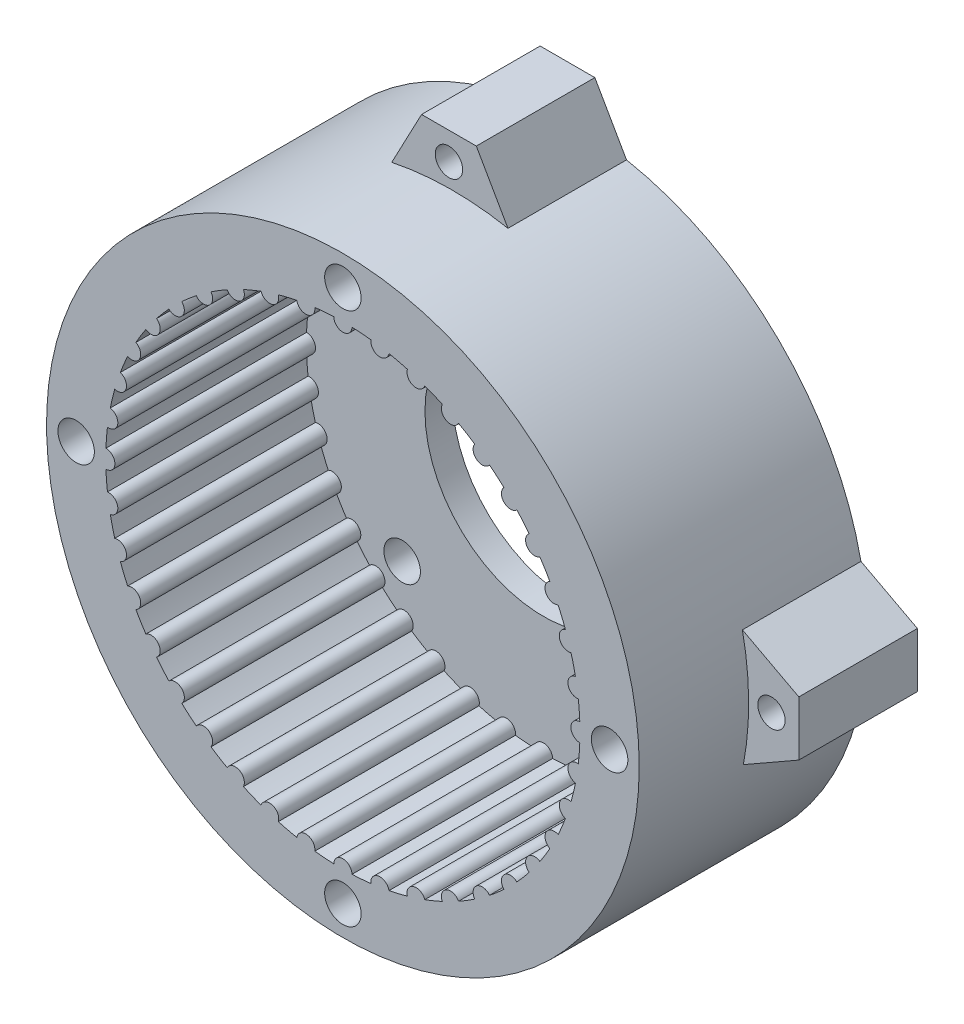
from build123d import *

# Parameters (mm, degrees)
ESQUISSE2_R                  = 32.5
BOSS_EXTRU_1_DEPTH           = 25
ESQUISSE3_R                  = 1
ENL_V_MAT_EXTRU_1_DEPTH      = 24
ESQUISSE4_R                  = 26
ENL_V_MAT_EXTRU_2_DEPTH      = 22
ESQUISSE5_R                  = 13
ENL_V_MAT_EXTRU_3_DEPTH      = 51.955863254
ESQUISSE6_R                  = 2
ENL_V_MAT_EXTRU_4_DEPTH      = 51.955863254
BOSS_EXTRU_2_START           = 24
ESQUISSE7_R                  = 1
BOSS_EXTRU_2_DEPTH           = 24
R_P_TITION_CIRCULAIRE1_COUNT = 40
ESQUISSE8_R                  = 2
ENL_V_MAT_EXTRU_5_DEPTH      = 7
R_P_TITION_CIRCULAIRE2_COUNT = 4
ESQUISSE9_R                  = 2
ENL_V_MAT_EXTRU_6_DEPTH      = 7
R_P_TITION_CIRCULAIRE3_COUNT = 4
BOSS_EXTRU_3_START           = -13
ESQUISSE11_R                 = 1.5
BOSS_EXTRU_3_DEPTH           = 13
R_P_TITION_CIRCULAIRE5_COUNT = 4


with BuildPart() as part:
    # Esquisse2 → Boss.-Extru.1 (new body)
    with BuildSketch(Plane.XY):
        Circle(ESQUISSE2_R)
    extrude(amount=BOSS_EXTRU_1_DEPTH)

    # Esquisse3 → Enlèv. mat.-Extru.1 (cut)
    with BuildSketch(Plane.XY.offset(25)):
        with Locations((0, 26)):
            Circle(ESQUISSE3_R)
        with Locations((4.067296091, 25.679896855)):
            Circle(ESQUISSE3_R)
        with Locations((8.034441854, 24.727469424)):
            Circle(ESQUISSE3_R)
        with Locations((11.803752993, 23.166169629)):
            Circle(ESQUISSE3_R)
        with Locations((15.28241656, 21.034441854)):
            Circle(ESQUISSE3_R)
        with Locations((18.384776311, 18.384776311)):
            Circle(ESQUISSE3_R)
        with Locations((21.034441854, 15.28241656)):
            Circle(ESQUISSE3_R)
        with Locations((23.166169629, 11.803752993)):
            Circle(ESQUISSE3_R)
        with Locations((24.727469424, 8.034441854)):
            Circle(ESQUISSE3_R)
        with Locations((25.679896855, 4.067296091)):
            Circle(ESQUISSE3_R)
        with Locations((26, 0)):
            Circle(ESQUISSE3_R)
        with Locations((25.679896855, -4.067296091)):
            Circle(ESQUISSE3_R)
        with Locations((24.727469424, -8.034441854)):
            Circle(ESQUISSE3_R)
        with Locations((23.166169629, -11.803752993)):
            Circle(ESQUISSE3_R)
        with Locations((21.034441854, -15.28241656)):
            Circle(ESQUISSE3_R)
        with Locations((18.384776311, -18.384776311)):
            Circle(ESQUISSE3_R)
        with Locations((15.28241656, -21.034441854)):
            Circle(ESQUISSE3_R)
        with Locations((11.803752993, -23.166169629)):
            Circle(ESQUISSE3_R)
        with Locations((8.034441854, -24.727469424)):
            Circle(ESQUISSE3_R)
        with Locations((4.067296091, -25.679896855)):
            Circle(ESQUISSE3_R)
        with Locations((0, -26)):
            Circle(ESQUISSE3_R)
        with Locations((-4.067296091, -25.679896855)):
            Circle(ESQUISSE3_R)
        with Locations((-8.034441854, -24.727469424)):
            Circle(ESQUISSE3_R)
        with Locations((-11.803752993, -23.166169629)):
            Circle(ESQUISSE3_R)
        with Locations((-15.28241656, -21.034441854)):
            Circle(ESQUISSE3_R)
        with Locations((-18.384776311, -18.384776311)):
            Circle(ESQUISSE3_R)
        with Locations((-21.034441854, -15.28241656)):
            Circle(ESQUISSE3_R)
        with Locations((-23.166169629, -11.803752993)):
            Circle(ESQUISSE3_R)
        with Locations((-24.727469424, -8.034441854)):
            Circle(ESQUISSE3_R)
        with Locations((-25.679896855, -4.067296091)):
            Circle(ESQUISSE3_R)
        with Locations((-26, 0)):
            Circle(ESQUISSE3_R)
        with Locations((-25.679896855, 4.067296091)):
            Circle(ESQUISSE3_R)
        with Locations((-24.727469424, 8.034441854)):
            Circle(ESQUISSE3_R)
        with Locations((-23.166169629, 11.803752993)):
            Circle(ESQUISSE3_R)
        with Locations((-21.034441854, 15.28241656)):
            Circle(ESQUISSE3_R)
        with Locations((-18.384776311, 18.384776311)):
            Circle(ESQUISSE3_R)
        with Locations((-15.28241656, 21.034441854)):
            Circle(ESQUISSE3_R)
        with Locations((-11.803752993, 23.166169629)):
            Circle(ESQUISSE3_R)
        with Locations((-8.034441854, 24.727469424)):
            Circle(ESQUISSE3_R)
        with Locations((-4.067296091, 25.679896855)):
            Circle(ESQUISSE3_R)
    extrude(amount=-ENL_V_MAT_EXTRU_1_DEPTH, mode=Mode.SUBTRACT)

    # Esquisse4 → Enlèv. mat.-Extru.2 (cut)
    with BuildSketch(Plane.XY.offset(25)):
        Circle(ESQUISSE4_R)
    extrude(amount=-ENL_V_MAT_EXTRU_2_DEPTH, mode=Mode.SUBTRACT)

    # Esquisse5 → Enlèv. mat.-Extru.3 (cut, through all)
    with BuildSketch(Plane.XY.offset(3)):
        Circle(ESQUISSE5_R)
    extrude(amount=-ENL_V_MAT_EXTRU_3_DEPTH, mode=Mode.SUBTRACT)

    # Esquisse6 → Enlèv. mat.-Extru.4 (cut, through all)
    with BuildSketch(Plane.XY.offset(3)):
        with Locations((-15.5, 15.5)):
            Circle(ESQUISSE6_R)
        with Locations((15.5, 15.5)):
            Circle(ESQUISSE6_R)
        with Locations((15.5, -15.5)):
            Circle(ESQUISSE6_R)
        with Locations((-15.5, -15.5)):
            Circle(ESQUISSE6_R)
    extrude(amount=-ENL_V_MAT_EXTRU_4_DEPTH, mode=Mode.SUBTRACT)

    # Esquisse7 → Boss.-Extru.2 (add)
    with BuildSketch(Plane.XY.offset(1).offset(BOSS_EXTRU_2_START)):
        with Locations((-21.034441854, 15.28241656)):
            Circle(ESQUISSE7_R)
    boss_extru_2 = extrude(amount=-BOSS_EXTRU_2_DEPTH)

    # Répétition circulaire1: Boss.-Extru.2 ×40 about axis
    r_p_tition_circulaire1_axis = Axis((0, 0, 0), (0, 0, 1))
    for i in range(1, R_P_TITION_CIRCULAIRE1_COUNT):
        add(boss_extru_2.rotate(r_p_tition_circulaire1_axis, i * 360 / R_P_TITION_CIRCULAIRE1_COUNT))

    # Esquisse8 → Enlèv. mat.-Extru.5 (cut)
    with BuildSketch(Plane.XY.offset(25)):
        with Locations((0, 29.25)):
            Circle(ESQUISSE8_R)
    enl_v_mat_extru_5 = extrude(amount=-ENL_V_MAT_EXTRU_5_DEPTH, mode=Mode.SUBTRACT)

    # Répétition circulaire2: Enlèv. mat.-Extru.5 ×4 about axis
    r_p_tition_circulaire2_axis = Axis((0, 0, 0), (0, 0, 1))
    for i in range(1, R_P_TITION_CIRCULAIRE2_COUNT):
        add(enl_v_mat_extru_5.rotate(r_p_tition_circulaire2_axis, i * 360 / R_P_TITION_CIRCULAIRE2_COUNT), mode=Mode.SUBTRACT)

    # Esquisse9 → Enlèv. mat.-Extru.6 (cut)
    with BuildSketch(Plane(origin=(0, 0, 0), x_dir=(-1, 0, 0), z_dir=(0, 0, -1))):
        with Locations((0, 28)):
            Circle(ESQUISSE9_R)
    enl_v_mat_extru_6 = extrude(amount=-ENL_V_MAT_EXTRU_6_DEPTH, mode=Mode.SUBTRACT)

    # Répétition circulaire3: Enlèv. mat.-Extru.6 ×4 about axis
    r_p_tition_circulaire3_axis = Axis((0, 0, 0), (0, 0, 1))
    for i in range(1, R_P_TITION_CIRCULAIRE3_COUNT):
        add(enl_v_mat_extru_6.rotate(r_p_tition_circulaire3_axis, i * 360 / R_P_TITION_CIRCULAIRE3_COUNT), mode=Mode.SUBTRACT)

    # Esquisse11 → Boss.-Extru.3 (add)
    with BuildSketch(Plane.XY.offset(13).offset(BOSS_EXTRU_3_START)):
        with BuildLine():
            Line((-6.644074322, 31.813617782), (-3.368608698, 38))
            Line((-3.368608698, 38), (2.631391302, 38))
            Line((2.631391302, 38), (6.103411428, 31.921753851))
            ThreePointArc((6.103411428, 31.921753851), (-0.275685407, 32.498830711), (-6.644074322, 31.813617782))
        make_face()
        with Locations((-0.368608698, 34.998058912)):
            Circle(ESQUISSE11_R, mode=Mode.SUBTRACT)
    boss_extru_3 = extrude(amount=BOSS_EXTRU_3_DEPTH)

    # Répétition circulaire5: Boss.-Extru.3 ×4 about axis
    r_p_tition_circulaire5_axis = Axis((0, 0, 0), (0, 0, 1))
    for i in range(1, R_P_TITION_CIRCULAIRE5_COUNT):
        add(boss_extru_3.rotate(r_p_tition_circulaire5_axis, i * 360 / R_P_TITION_CIRCULAIRE5_COUNT))


solid = part.part
